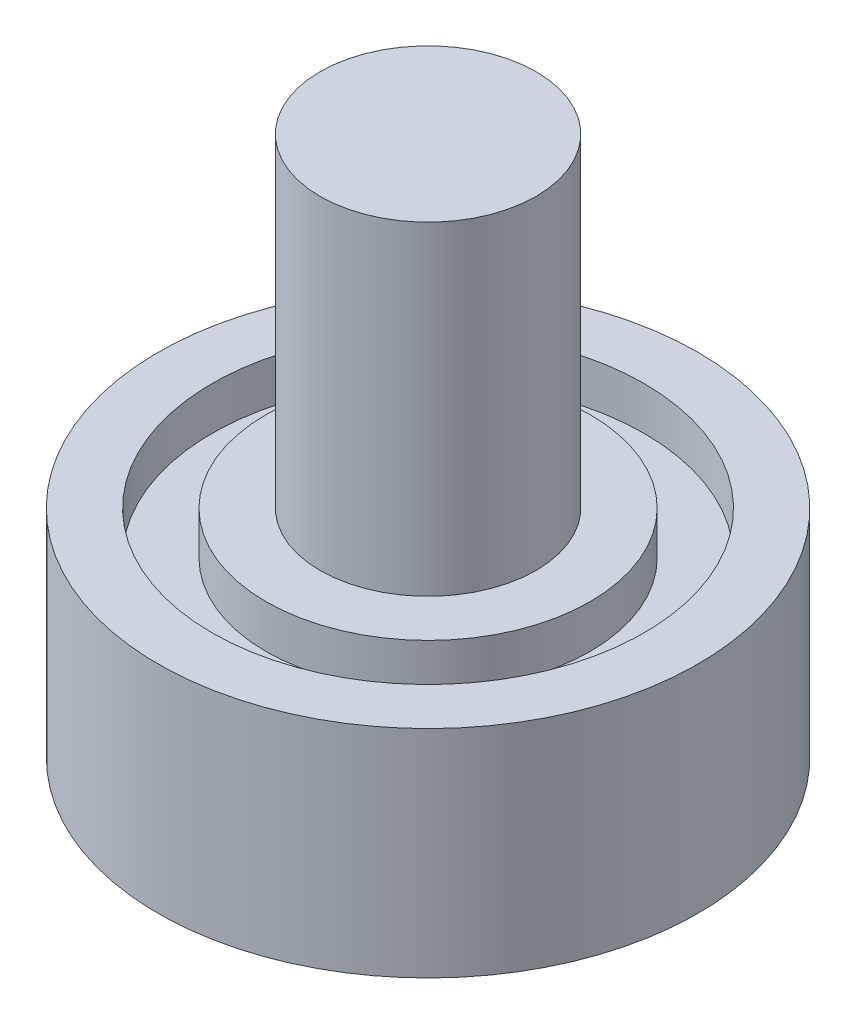
from build123d import *

# Parameters (mm, degrees)
SKETCH2_R           = 3
BOSS_EXTRUDE1_DEPTH = 1


with BuildPart() as part:
    # Sketch1 → Revolve1 (revolve)
    with BuildSketch(Plane.XY, mode=Mode.PRIVATE) as revolve1_sk:
        Polygon((0, 0), (2.5, 0), (2.5, 4), (7.5, 4), (7.5, 6), (10, 6), (10, 4), (12.497669608, 4), (12.497669608, 14), (10, 14), (10, 12), (7.5, 12), (7.5, 14), (5, 14), (5, 29), (0, 29), align=None)
    revolve(revolve1_sk.sketch.rotate(Axis((0, 0, 0), (0, 1, 0)), 90), axis=Axis((0, 0, 0), (0, 1, 0)))

    # Sketch2 → Boss-Extrude1 (add)
    with BuildSketch(Plane.XZ.offset(-4)):
        with Locations(Location((0, 0, 0), (0, 0, 270))):
            Circle(SKETCH2_R)
    extrude(amount=BOSS_EXTRUDE1_DEPTH)


solid = part.part
